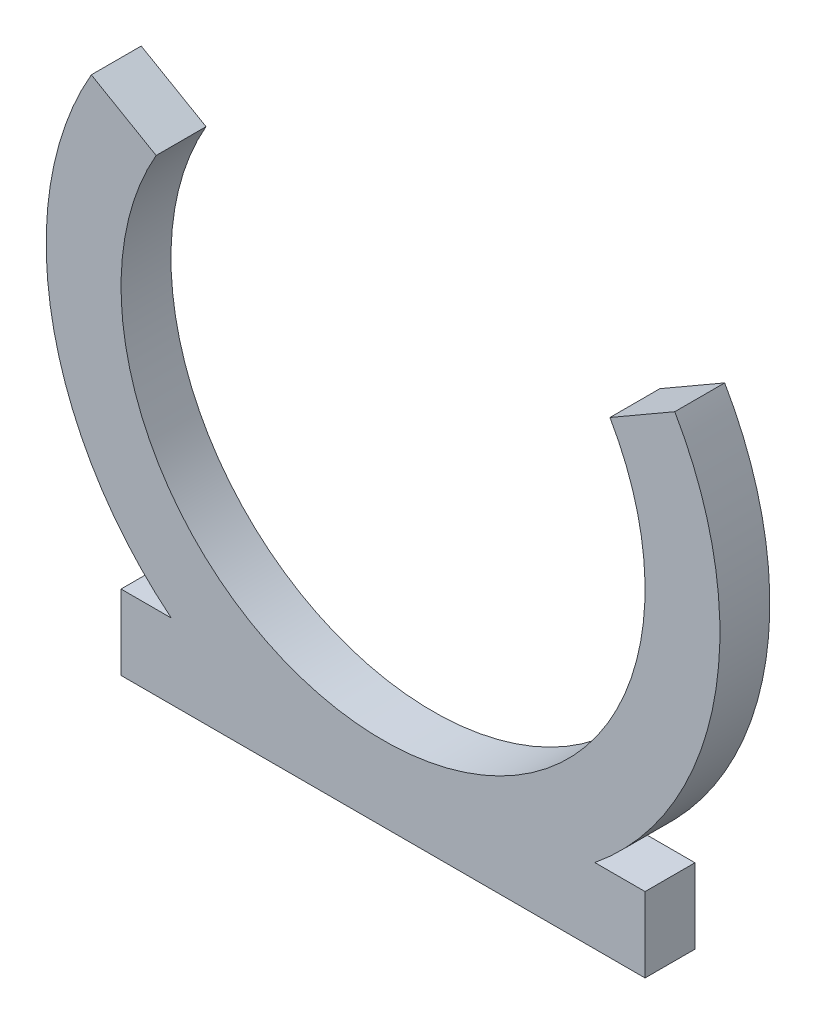
from build123d import *

# Parameters (mm, degrees)
BOSS_EXTRUDE1_DEPTH = 2


with BuildPart() as part:
    # Sketch1 → Boss-Extrude1 (new body)
    with BuildSketch(Plane.XY):
        with BuildLine():
            Line((-9.09326674, 5.25), (-11.691342951, 6.75))
            ThreePointArc((-11.691342951, 6.75), (-13.272703843, -2.466846714), (-8.485281374, -10.5))
            Line((-8.485281374, -10.5), (-10.5, -10.5))
            Line((-10.5, -10.5), (-10.5, -13.5))
            Line((-10.5, -13.5), (10.5, -13.5))
            Line((10.5, -13.5), (10.5, -10.5))
            Line((10.5, -10.5), (8.485281374, -10.5))
            ThreePointArc((8.485281374, -10.5), (13.272703843, -2.466846714), (11.691342951, 6.75))
            Line((11.691342951, 6.75), (9.09326674, 5.25))
            ThreePointArc((9.09326674, 5.25), (0, -10.5), (-9.09326674, 5.25))
        make_face()
    extrude(amount=BOSS_EXTRUDE1_DEPTH)


solid = part.part
